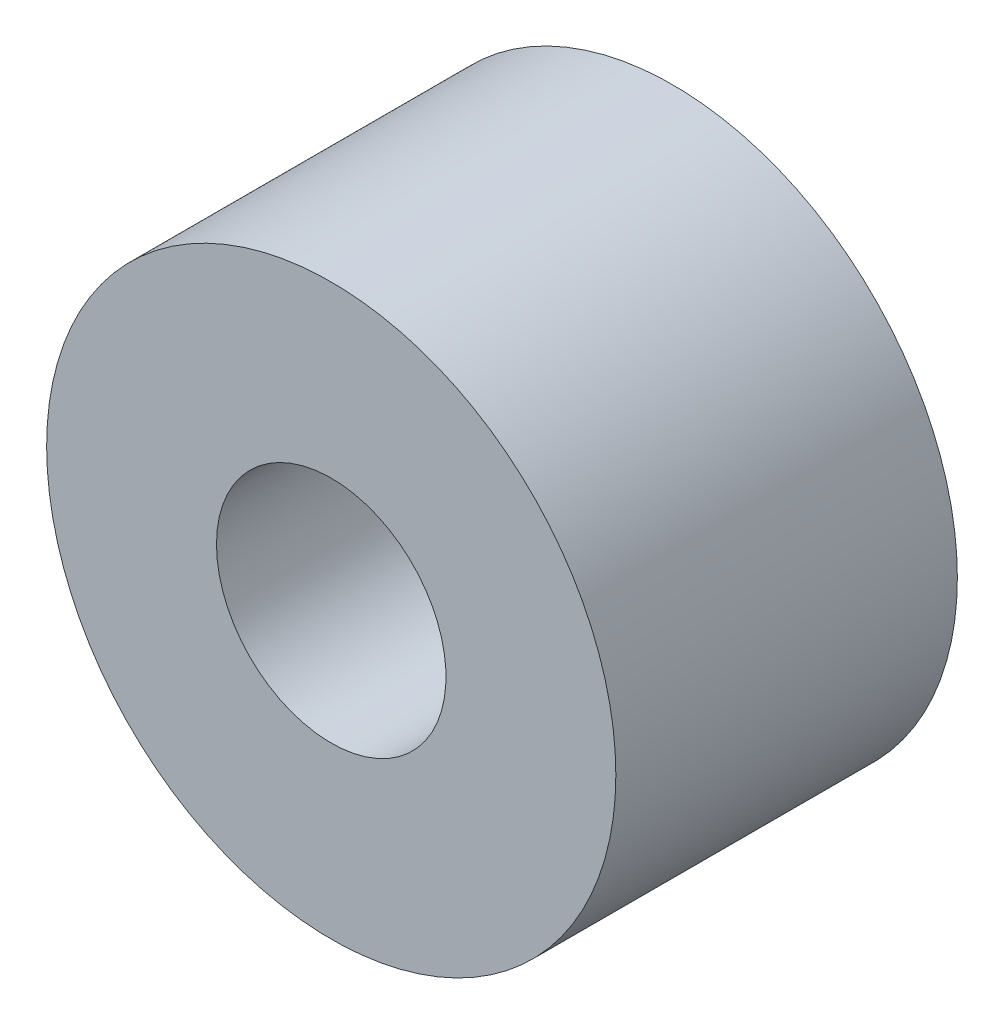
from build123d import *

# Parameters (mm, degrees)
SKETCH1_R      = 7.9375
SKETCH1_R_2    = 3.2004
EXTRUDE1_DEPTH = 4.7625


with BuildPart() as part:
    # Sketch1 → Extrude1 (new, symmetric)
    with BuildSketch(Plane.XY):
        with Locations(Location((0, 0, 0), (0, 0, 180))):
            Circle(SKETCH1_R)
        with Locations(Location((0, 0, 0), (0, 0, 180))):
            Circle(SKETCH1_R_2, mode=Mode.SUBTRACT)
    extrude(amount=EXTRUDE1_DEPTH, both=True)


solid = part.part
